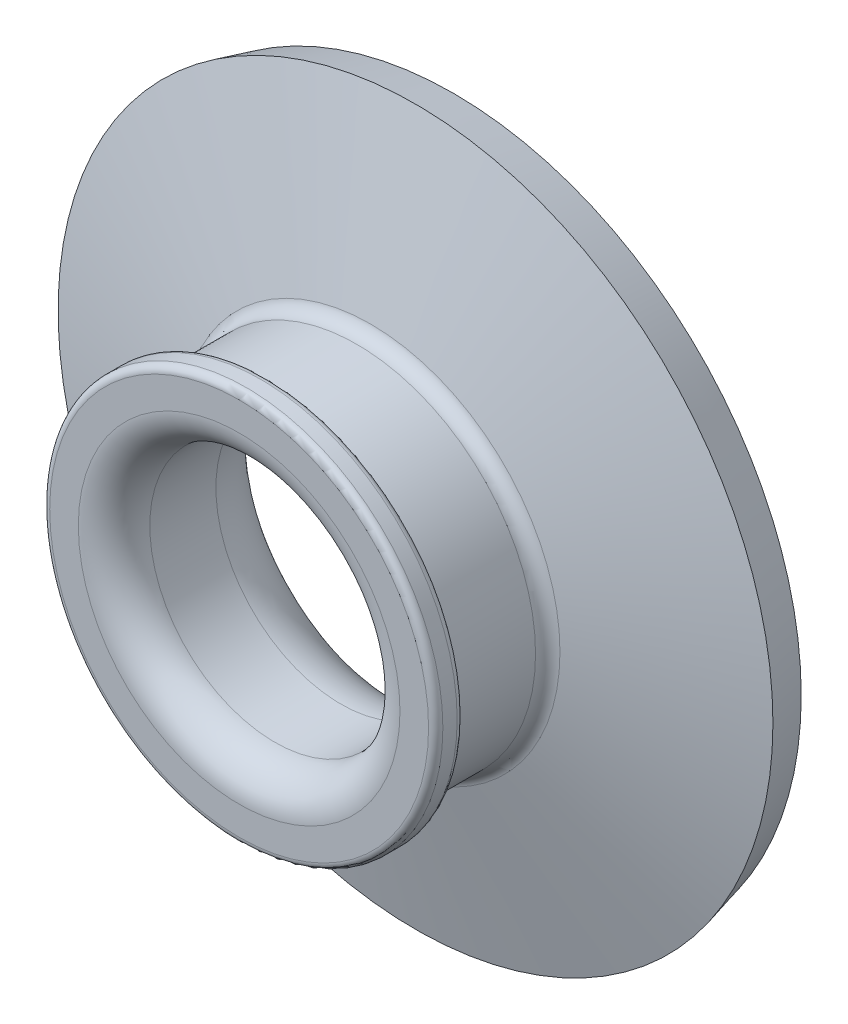
from build123d import *


with BuildPart() as part:
    # Sketch1 → Revolve1 (revolve)
    with BuildSketch(Plane(origin=(0, 0, 0), x_dir=(0, 0, -1), z_dir=(1, 0, 0)), mode=Mode.PRIVATE) as revolve1_sk:
        with BuildLine():
            Line((0, 26.5), (0, 22.5))
            ThreePointArc((0, 22.5), (1.464466094, 18.964466094), (5, 17.5))
            Line((5, 17.5), (14.244868029, 17.5))
            ThreePointArc((14.244868029, 17.5), (20.373117991, 19.597813442), (23.930182924, 25.011089519))
            Line((23.930182924, 25.011089519), (30, 48.631099236))
            Line((30, 48.631099236), (24.673076808, 50))
            Line((24.673076808, 50), (18.396170465, 26.484212143))
            ThreePointArc((18.396170465, 26.484212143), (17.68210645, 25.413876469), (16.463823993, 25))
            Line((16.463823993, 25), (5, 25))
            ThreePointArc((5, 25), (4.292893219, 25.292893219), (4, 26))
            Line((4, 26), (4, 26.5))
            ThreePointArc((4, 26.5), (3.707106781, 27.207106781), (3, 27.5))
            Line((3, 27.5), (1, 27.5))
            ThreePointArc((1, 27.5), (0.292893219, 27.207106781), (0, 26.5))
        make_face()
    revolve(revolve1_sk.sketch.rotate(Axis((0, 0, 0), (0, 0, -1)), 90), axis=Axis((0, 0, 0), (0, 0, -1)))


solid = part.part
